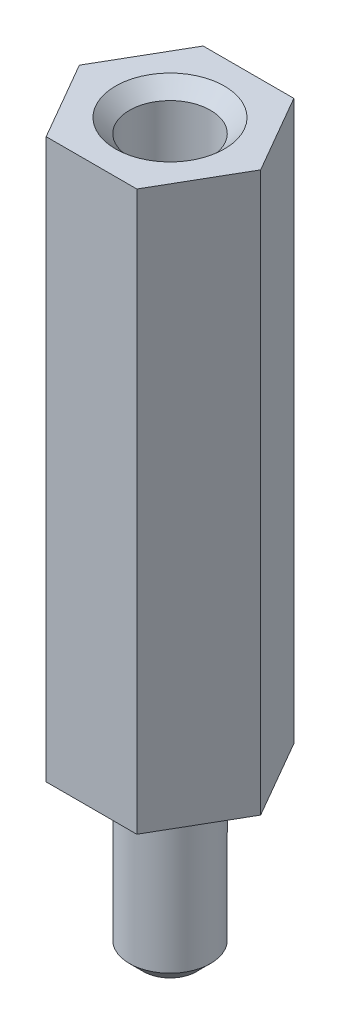
from build123d import *

# Parameters (mm, degrees)
BOSS_EXTRUDE1_DEPTH            = 20
SKETCH2_W                      = 1.45
SKETCH2_H                      = 6
F_2_9_2_9_DIAMETER_HOLE1_D     = 2.9
F_2_9_2_9_DIAMETER_HOLE1_DEPTH = 5
CHAMFER1_SIZE                  = 0.5


with BuildPart() as part:
    # Sketch1 → Boss-Extrude1 (new body)
    with BuildSketch(Plane(origin=(0, 20, 0), x_dir=(1, 0, 0), z_dir=(0, 1, 0))):
        Polygon((1.622354256, -2.81), (3.244708513, 0), (1.622354256, 2.81), (-1.622354256, 2.81), (-3.244708513, 0), (-1.622354256, -2.81), align=None)
    extrude(amount=-BOSS_EXTRUDE1_DEPTH)

    # Sketch2 → Revolve1 (revolve)
    with BuildSketch(Plane(origin=(0, 0, 0), x_dir=(-1, 0, 0), z_dir=(0, 0, -1)), mode=Mode.PRIVATE) as revolve1_sk:
        with Locations((-0.725, -3)):
            Rectangle(SKETCH2_W, SKETCH2_H)
    revolve(revolve1_sk.sketch.rotate(Axis((0, -6, 0), (0, 1, 0)), 270), axis=Axis((0, -6, 0), (0, 1, 0)))

    # Ø2.9 (2.9) Diameter Hole1
    with Locations(Plane(origin=(0, 20, 0), x_dir=(1, 0, 0), z_dir=(0, 1, 0))):
        with Locations((0, 0)):
            Hole(F_2_9_2_9_DIAMETER_HOLE1_D / 2, depth=F_2_9_2_9_DIAMETER_HOLE1_DEPTH)

    # Chamfer1
    chamfer1_edges = [part.edges().sort_by_distance(p)[0] for p in [
        (0, -6, -1.45),
        (1.45, 20, 0),
    ]]
    chamfer(chamfer1_edges, length=CHAMFER1_SIZE)


solid = part.part
